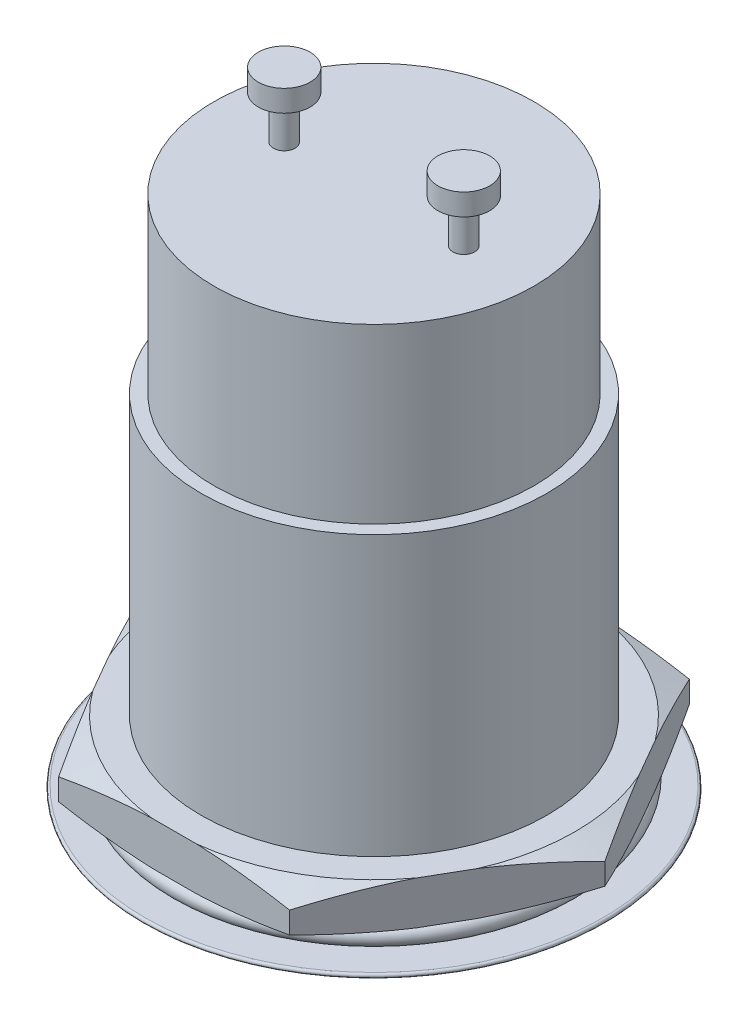
from build123d import *

# Parameters (mm, degrees)
SKETCH_2_R          = 8
EXTRUDE_1_DEPTH     = 22.9
SKETCH_4_R          = 10.68097998
EXTRUDE_3_DEPTH     = 2
CHAMFER_1_SIZE      = 0.5
CHAMFER_1_SIZE2     = 1.37373871
CHAMFER_2_SIZE      = 0.5
CHAMFER_2_SIZE2     = 1.37373871
CUT_EXTRUDE_1_DEPTH = 2
SKETCH_9_W          = 0.6
SKETCH_9_H          = 8


with BuildPart() as part:
    # 草图2 → 凸台-拉伸1 (new body)
    with BuildSketch(Plane(origin=(0, 0, 0), x_dir=(1, 0, 0), z_dir=(0, 1, 0))):
        with Locations(Location((0, 0, 0), (0, 0, 270))):
            Circle(SKETCH_2_R)
    extrude(amount=EXTRUDE_1_DEPTH)

    # 草图4 → 凸台-拉伸3 (add)
    with BuildSketch(Plane.XZ):
        with Locations(Location((0, 0, 0), (0, 0, 270))):
            Circle(SKETCH_4_R)
    extrude(amount=-EXTRUDE_3_DEPTH)

    # 倒角1
    chamfer_1_edges = [part.edges().sort_by_distance(p)[0] for p in [
        (0, 0, 10.68097998),
    ]]
    chamfer_1_side = [part.faces().sort_by_distance(p)[0] for p in [
        (0, 1, 10.68097998),
    ]]
    chamfer(chamfer_1_edges, length=CHAMFER_1_SIZE, length2=CHAMFER_1_SIZE2, reference=chamfer_1_side[0])

    # 倒角2
    chamfer_2_edges = [part.edges().sort_by_distance(p)[0] for p in [
        (0, 2, 10.68097998),
    ]]
    chamfer_2_side = [part.faces().sort_by_distance(p)[0] for p in [
        (0, 1.25, 10.68097998),
    ]]
    chamfer(chamfer_2_edges, length=CHAMFER_2_SIZE, length2=CHAMFER_2_SIZE2, reference=chamfer_2_side[0])

    # 草图1 → 切除-拉伸1 (cut)
    with BuildSketch(Plane(origin=(0, 0, 0), x_dir=(1, 0, 0), z_dir=(0, 1, 0))):
        with BuildLine():
            Line((5.34048999, 9.25), (10.68097998, 0))
            ThreePointArc((10.68097998, 0), (9.25, 5.34048999), (5.34048999, 9.25))
        make_face()
        with BuildLine():
            Line((-5.34048999, 9.25), (5.34048999, 9.25))
            ThreePointArc((5.34048999, 9.25), (0, 10.68097998), (-5.34048999, 9.25))
        make_face()
        with BuildLine():
            ThreePointArc((5.34048999, -9.25), (9.25, -5.34048999), (10.68097998, 0))
            Line((10.68097998, 0), (5.34048999, -9.25))
        make_face()
        with BuildLine():
            ThreePointArc((-5.34048999, -9.25), (0, -10.68097998), (5.34048999, -9.25))
            Line((5.34048999, -9.25), (-5.34048999, -9.25))
        make_face()
        with BuildLine():
            ThreePointArc((-10.68097998, 0), (-9.25, -5.34048999), (-5.34048999, -9.25))
            Line((-5.34048999, -9.25), (-10.68097998, 0))
        make_face()
        with BuildLine():
            Line((-10.68097998, 0), (-5.34048999, 9.25))
            ThreePointArc((-5.34048999, 9.25), (-9.25, 5.34048999), (-10.68097998, 0))
        make_face()
    extrude(amount=CUT_EXTRUDE_1_DEPTH, mode=Mode.SUBTRACT)

    # 草图6 → 旋转1 (revolve)
    with BuildSketch(Plane.XY, mode=Mode.PRIVATE) as revolve_1_sk:
        with BuildLine():
            Line((0, 0), (9, 0))
            ThreePointArc((9, 0), (9.4, -0.4), (9, -0.8))
            Line((9, -0.8), (0, -0.8))
            Line((0, -0.8), (0, 0))
        make_face()
    revolve(revolve_1_sk.sketch.rotate(Axis((0, 0, 0), (0, -1, 0)), 270), axis=Axis((0, 0, 0), (0, -1, 0)))

    # 草图7 → 旋转2 (revolve)
    with BuildSketch(Plane.XY, mode=Mode.PRIVATE) as revolve_2_sk:
        with BuildLine():
            Line((0, -0.8), (10.6, -0.8))
            ThreePointArc((10.6, -0.8), (10.69701425, -0.875746437), (10.647058824, -0.988235294))
            Line((10.647058824, -0.988235294), (8.441176471, -2.164705882))
            ThreePointArc((8.441176471, -2.164705882), (7.98507125, -2.340285), (7.5, -2.4))
            Line((7.5, -2.4), (0, -2.4))
            Line((0, -2.4), (0, -0.8))
        make_face()
    revolve(revolve_2_sk.sketch.rotate(Axis((0, -2.4, 0), (0, 1, 0)), 90), axis=Axis((0, -2.4, 0), (0, 1, 0)))

    # 草图9 → 切除-旋转1 (revolve, cut)
    with BuildSketch(Plane.XY, mode=Mode.PRIVATE) as cut_revolve_1_sk:
        with Locations((7.7, 18.9)):
            Rectangle(SKETCH_9_W, SKETCH_9_H)
    revolve(cut_revolve_1_sk.sketch.rotate(Axis((0, 0, 0), (0, 1, 0)), 90), axis=Axis((0, 0, 0), (0, 1, 0)), mode=Mode.SUBTRACT)

    # 草图10 → 旋转4 (revolve)
    with BuildSketch(Plane.XY, mode=Mode.PRIVATE) as revolve_4_sk:
        Polygon((4.153927956, 22.9), (4.653927956, 22.9), (4.653927956, 24.9), (5.353927956, 24.9), (5.353927956, 25.9), (4.153927956, 25.9), align=None)
    revolve_4 = revolve(revolve_4_sk.sketch.rotate(Axis((4.153927956, 22.9, 0), (0, 1, 0)), 90), axis=Axis((4.153927956, 22.9, 0), (0, 1, 0)))

    # 镜向1: 旋转4 across plane
    add(revolve_4.mirror(Plane(origin=(0, 0, 0), x_dir=(0, 0, 1), z_dir=(1, 0, 0))))


solid = part.part
